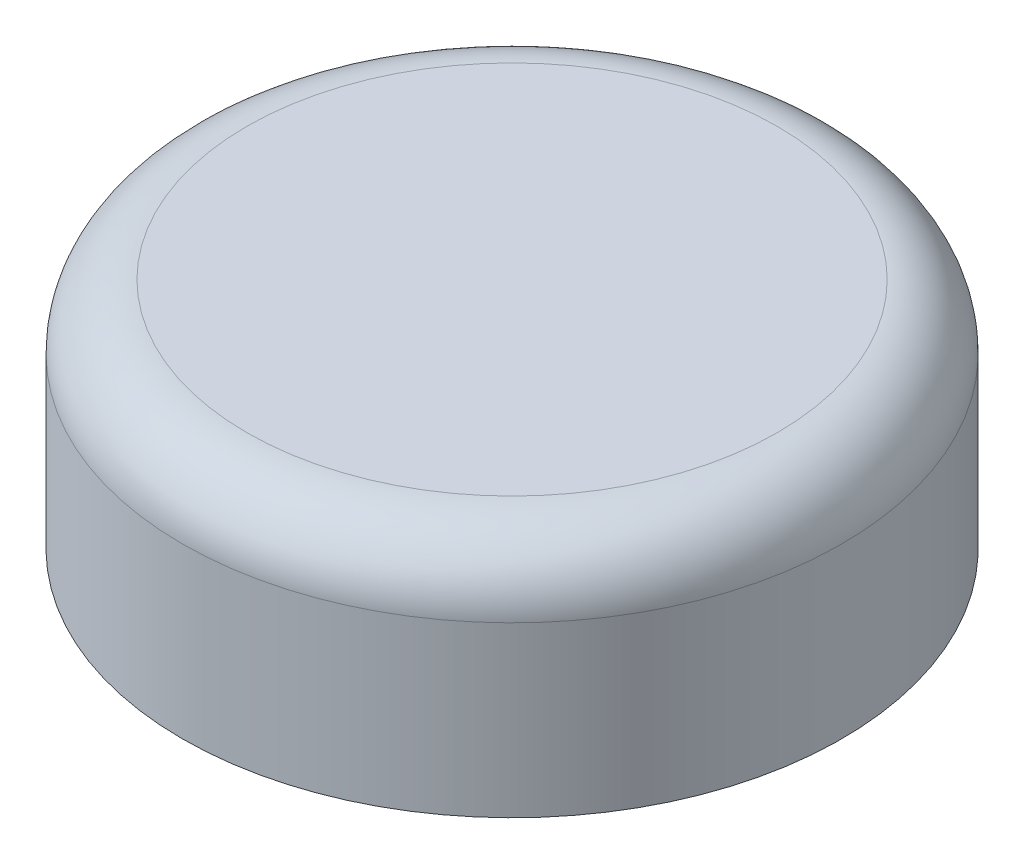
from build123d import *

# Parameters (mm, degrees)
THICKEN1_T1 = 1


with BuildPart() as body_1:
    # Surface-Revolve1: a surface, the sketch's curves turned about an axis
    with BuildLine(Plane.XY, mode=Mode.PRIVATE) as surface_revolve1_1_path:
        Line((0, 14.5), (16.5, 14.5))
        ThreePointArc((16.5, 14.5), (19.328427125, 13.328427125), (20.5, 10.5))
        Line((20.5, 10.5), (20.5, 0))
    surface_revolve1_1 = Shell.revolve(surface_revolve1_1_path.wire(), 360, Axis((0, 0, 0), (0, 1, 0)))
    add(Solid.thicken(surface_revolve1_1, THICKEN1_T1))

    # Sweep1: sweep along a curve in space
    with BuildLine() as sweep1_path:
        add(Edge.make_bspline(
            [(0, 1.5, -20.5), (-1.677288291, 1.552087556, -20.369781111), (-3.321927619, 1.604166667, -20.032778015), (-5.277242539, 1.669270833, -19.375208287), (-5.663299709, 1.682291667, -19.231935866), (-6.424016529, 1.708333333, -18.922648859), (-6.816249257, 1.721354167, -18.807075196), (-7.961203679, 1.760416667, -18.365417539), (-8.70641459, 1.786458333, -18.02408584), (-12.314015324, 1.916666667, -16.095783074), (-14.811292911, 2.020833333, -13.832382603), (-18.447491581, 2.229166667, -8.390426718), (-19.582934192, 2.333333333, -5.217077208), (-20.224454875, 2.541666667, 1.296391595), (-19.729919254, 2.645833333, 4.630279948), (-17.225262047, 2.854166667, 10.677057346), (-15.217536475, 2.958333333, 13.3841619), (-10.158194891, 3.166666667, 17.536256234), (-7.111418764, 3.270833333, 18.977274022), (-0.692194117, 3.479166667, 20.254137194), (2.674113621, 3.583333333, 20.088761099), (8.93727347, 3.791666667, 18.18885233), (11.828134094, 3.895833333, 16.456137153), (16.456137153, 4.104166667, 11.828134094), (18.18885233, 4.208333333, 8.93727347), (20.088761099, 4.416666667, 2.674113621), (20.254137194, 4.520833333, -0.692194117), (18.977274022, 4.729166667, -7.111418764), (17.536256234, 4.833333333, -10.158194891), (13.3841619, 5.041666667, -15.217536475), (10.677057346, 5.145833333, -17.225262047), (4.630279948, 5.354166667, -19.729919254), (1.296391595, 5.458333333, -20.224454875), (-5.217077208, 5.666666667, -19.582934192), (-8.390426718, 5.770833333, -18.447491581), (-13.832382603, 5.979166667, -14.811292911), (-16.095783074, 6.083333333, -12.314015324), (-18.02408584, 6.213541667, -8.70641459), (-18.365417539, 6.239583333, -7.961203679), (-18.807075196, 6.278645833, -6.816249257), (-18.922648859, 6.291666667, -6.424016529), (-19.231935866, 6.317708333, -5.663299709), (-19.375208287, 6.330729167, -5.277242539), (-20.032778015, 6.395833333, -3.321927619), (-20.369781111, 6.447912444, -1.677288291), (-20.5, 6.5, 0)],
            knots=[0, 0, 0, 0, 0.03125, 0.03125, 0.0390625, 0.0390625, 0.046875, 0.046875, 0.0625, 0.0625, 0.125, 0.125, 0.1875, 0.1875, 0.25, 0.25, 0.3125, 0.3125, 0.375, 0.375, 0.4375, 0.4375, 0.5, 0.5, 0.5625, 0.5625, 0.625, 0.625, 0.6875, 0.6875, 0.75, 0.75, 0.8125, 0.8125, 0.875, 0.875, 0.9375, 0.9375, 0.953125, 0.953125, 0.9609375, 0.9609375, 0.96875, 0.96875, 1, 1, 1, 1], degree=3))
    with BuildLine() as sweep1_axis:
        Line((0, 6.5, 0), (0, 1.5, 0))
    # Sketch3 → Sweep1 (sweep)
    with BuildSketch(Plane(origin=(0, 0, 0), x_dir=(0, 0, -1), z_dir=(1, 0, 0))):
        Polygon((19.5, 1.6), (19.5, 1.4), (20.5, 1), (20.5, 2), align=None)
    sweep(path=sweep1_path.line, binormal=sweep1_axis.edges()[0])


solid = body_1.part
